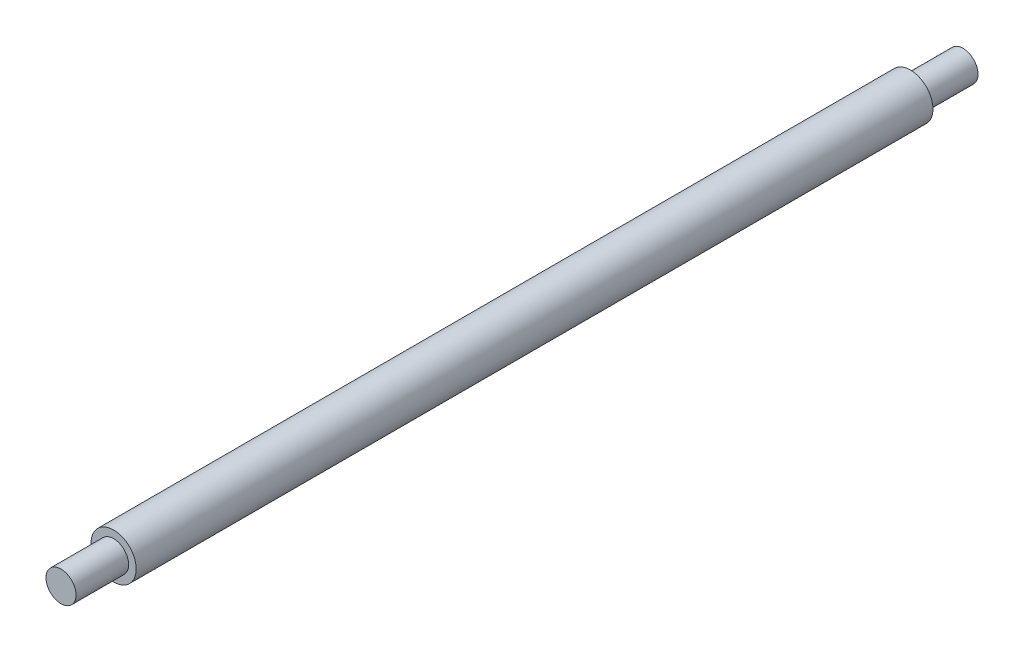
from build123d import *

# Parameters (mm, degrees)
SKETCH1_R           = 9.525
BOSS_EXTRUDE1_DEPTH = 336.55
SKETCH2_R           = 6.35
BOSS_EXTRUDE2_DEPTH = 22.225
BOSS_EXTRUDE3_START = 22.225
SKETCH3_R           = 6.35
BOSS_EXTRUDE3_DEPTH = 22.225


with BuildPart() as part:
    # Sketch1 → Boss-Extrude1 (new body)
    with BuildSketch(Plane.XY):
        Circle(SKETCH1_R)
    extrude(amount=BOSS_EXTRUDE1_DEPTH)

    # Sketch2 → Boss-Extrude2 (add)
    with BuildSketch(Plane.XY.offset(336.55)):
        Circle(SKETCH2_R)
    extrude(amount=BOSS_EXTRUDE2_DEPTH)

    # Sketch3 → Boss-Extrude3 (add)
    with BuildSketch(Plane(origin=(0, 0, 0), x_dir=(-1, 0, 0), z_dir=(0, 0, -1)).offset(BOSS_EXTRUDE3_START)):
        with Locations(Location((0, 0, 0), (0, 0, 180))):
            Circle(SKETCH3_R)
    extrude(amount=-BOSS_EXTRUDE3_DEPTH)


solid = part.part
